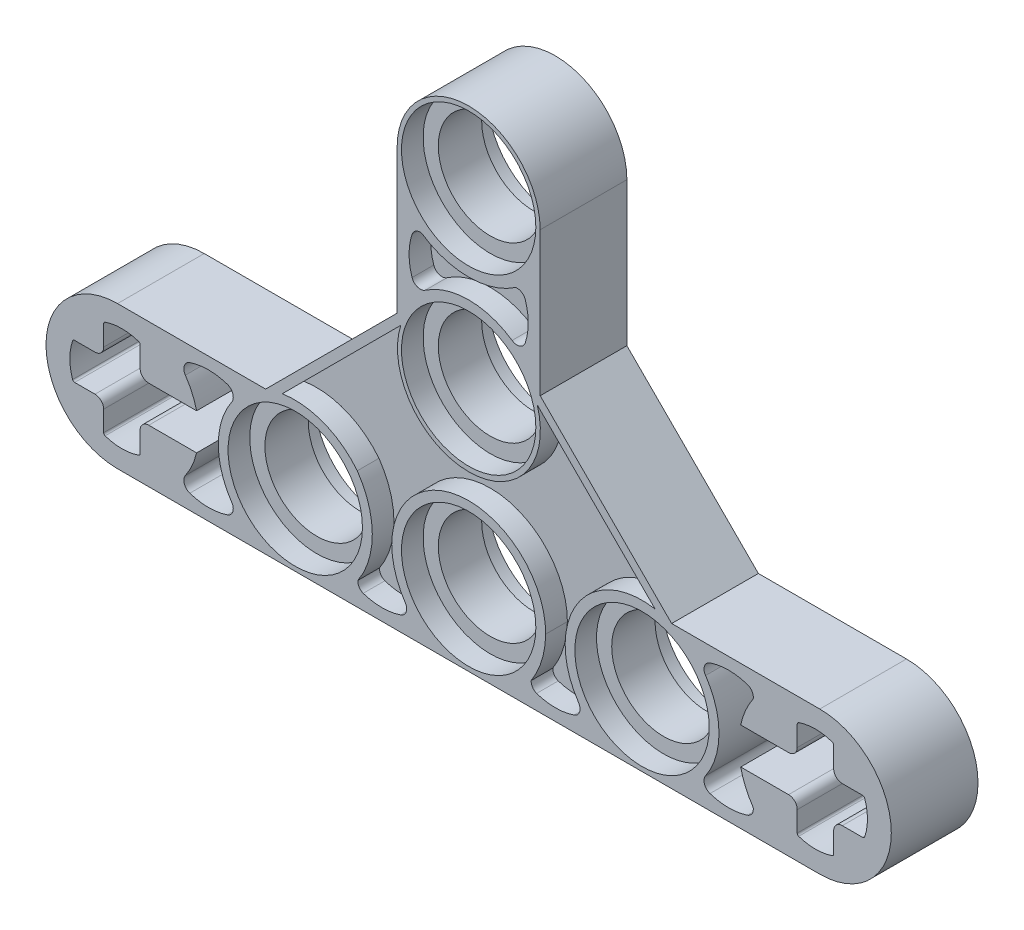
from build123d import *

# Parameters (mm, degrees)
SKETCH2_R           = 2.4
BOSS_EXTRUDE1_DEPTH = 2
SKETCH4_R           = 3.1
CUT_EXTRUDE1_DEPTH  = 1
CUT_EXTRUDE2_DEPTH  = 1


with BuildPart() as part:
    # Sketch2 → Boss-Extrude1 (new, symmetric)
    with BuildSketch(Plane.XY):
        with BuildLine():
            Line((-16.2, -3.3), (16.2, -3.3))
            ThreePointArc((16.2, -3.3), (19.5, 0), (16.2, 3.3))
            Line((16.2, 3.3), (9.366904756, 3.3))
            Line((9.366904756, 3.3), (3.3, 9.366904756))
            Line((3.3, 9.366904756), (3.3, 16))
            ThreePointArc((3.3, 16), (0, 19.3), (-3.3, 16))
            Line((-3.3, 16), (-3.3, 9.366904756))
            Line((-3.3, 9.366904756), (-9.366904756, 3.3))
            Line((-9.366904756, 3.3), (-16.2, 3.3))
            ThreePointArc((-16.2, 3.3), (-19.5, 0), (-16.2, -3.3))
        make_face()
        with BuildLine():
            Line((-18.177705214, 0.84), (-17.24, 0.84))
            ThreePointArc((-17.24, 0.84), (-16.957157288, 0.957157288), (-16.84, 1.24))
            Line((-16.84, 1.24), (-16.84, 2.177705214))
            ThreePointArc((-16.84, 2.177705214), (-16.821293884, 2.235940121), (-16.772173913, 2.27238805))
            ThreePointArc((-16.772173913, 2.27238805), (-16, 2.4), (-15.227826087, 2.27238805))
            ThreePointArc((-15.227826087, 2.27238805), (-15.178706116, 2.235940121), (-15.16, 2.177705214))
            Line((-15.16, 2.177705214), (-15.16, 1.24))
            ThreePointArc((-15.16, 1.24), (-15.042842712, 0.957157288), (-14.76, 0.84))
            Line((-14.76, 0.84), (-13.822294786, 0.84))
            Line((-13.822294786, 0.84), (-13.751800721, 0.84))
            Line((-13.751800721, 0.84), (-12.55081169, 0.84))
            ThreePointArc((-12.55081169, 0.84), (-12.757752494, 1.445797742), (-13.070126582, 2.004580194))
            ThreePointArc((-13.070126582, 2.004580194), (-13.119033599, 2.358251088), (-12.865957447, 2.610099174))
            ThreePointArc((-12.865957447, 2.610099174), (-12, 2.75), (-11.134042553, 2.610099174))
            ThreePointArc((-11.134042553, 2.610099174), (-10.880966401, 2.358251088), (-10.929873418, 2.004580194))
            ThreePointArc((-10.929873418, 2.004580194), (-11.55, 0), (-10.929873418, -2.004580194))
            ThreePointArc((-10.929873418, -2.004580194), (-10.880966401, -2.358251088), (-11.134042553, -2.610099174))
            ThreePointArc((-11.134042553, -2.610099174), (-12, -2.75), (-12.865957447, -2.610099174))
            ThreePointArc((-12.865957447, -2.610099174), (-13.119033599, -2.358251088), (-13.070126582, -2.004580194))
            ThreePointArc((-13.070126582, -2.004580194), (-12.757752494, -1.445797742), (-12.55081169, -0.84))
            Line((-12.55081169, -0.84), (-13.751800721, -0.84))
            Line((-13.751800721, -0.84), (-13.822294786, -0.84))
            Line((-13.822294786, -0.84), (-14.76, -0.84))
            ThreePointArc((-14.76, -0.84), (-15.042842712, -0.957157288), (-15.16, -1.24))
            Line((-15.16, -1.24), (-15.16, -2.177705214))
            ThreePointArc((-15.16, -2.177705214), (-15.178706116, -2.235940121), (-15.227826087, -2.27238805))
            ThreePointArc((-15.227826087, -2.27238805), (-16, -2.4), (-16.772173913, -2.27238805))
            ThreePointArc((-16.772173913, -2.27238805), (-16.821293884, -2.235940121), (-16.84, -2.177705214))
            Line((-16.84, -2.177705214), (-16.84, -1.24))
            ThreePointArc((-16.84, -1.24), (-16.957157288, -0.957157288), (-17.24, -0.84))
            Line((-17.24, -0.84), (-18.177705214, -0.84))
            ThreePointArc((-18.177705214, -0.84), (-18.235940121, -0.821293884), (-18.27238805, -0.772173913))
            ThreePointArc((-18.27238805, -0.772173913), (-18.4, 0), (-18.27238805, 0.772173913))
            ThreePointArc((-18.27238805, 0.772173913), (-18.235940121, 0.821293884), (-18.177705214, 0.84))
        make_face(mode=Mode.SUBTRACT)
        with Locations((-8, 0)):
            Circle(SKETCH2_R, mode=Mode.SUBTRACT)
        Circle(SKETCH2_R, mode=Mode.SUBTRACT)
        with Locations((8, 0)):
            Circle(SKETCH2_R, mode=Mode.SUBTRACT)
        with BuildLine():
            Line((16.84, 2.177705214), (16.84, 1.24))
            ThreePointArc((16.84, 1.24), (16.957157288, 0.957157288), (17.24, 0.84))
            Line((17.24, 0.84), (18.177705214, 0.84))
            ThreePointArc((18.177705214, 0.84), (18.235940121, 0.821293884), (18.27238805, 0.772173913))
            ThreePointArc((18.27238805, 0.772173913), (18.4, 0), (18.27238805, -0.772173913))
            ThreePointArc((18.27238805, -0.772173913), (18.235940121, -0.821293884), (18.177705214, -0.84))
            Line((18.177705214, -0.84), (17.24, -0.84))
            ThreePointArc((17.24, -0.84), (16.957157288, -0.957157288), (16.84, -1.24))
            Line((16.84, -1.24), (16.84, -2.177705214))
            ThreePointArc((16.84, -2.177705214), (16.821293884, -2.235940121), (16.772173913, -2.27238805))
            ThreePointArc((16.772173913, -2.27238805), (16, -2.4), (15.227826087, -2.27238805))
            ThreePointArc((15.227826087, -2.27238805), (15.178706116, -2.235940121), (15.16, -2.177705214))
            Line((15.16, -2.177705214), (15.16, -1.24))
            ThreePointArc((15.16, -1.24), (15.042842712, -0.957157288), (14.76, -0.84))
            Line((14.76, -0.84), (13.822294786, -0.84))
            Line((13.822294786, -0.84), (13.751800721, -0.84))
            Line((13.751800721, -0.84), (12.55081169, -0.84))
            ThreePointArc((12.55081169, -0.84), (12.776635558, -1.532291094), (13.129021511, -2.169541059))
            ThreePointArc((13.129021511, -2.169541059), (13.077439209, -2.437559337), (12.865957447, -2.610099174))
            ThreePointArc((12.865957447, -2.610099174), (12, -2.75), (11.134042553, -2.610099174))
            ThreePointArc((11.134042553, -2.610099174), (10.880966401, -2.358251088), (10.929873418, -2.004580194))
            ThreePointArc((10.929873418, -2.004580194), (11.55, 0), (10.929873418, 2.004580194))
            ThreePointArc((10.929873418, 2.004580194), (10.880966401, 2.358251088), (11.134042553, 2.610099174))
            ThreePointArc((11.134042553, 2.610099174), (12, 2.75), (12.865957447, 2.610099174))
            ThreePointArc((12.865957447, 2.610099174), (13.077439209, 2.437559337), (13.129021511, 2.169541059))
            ThreePointArc((13.129021511, 2.169541059), (12.776635558, 1.532291094), (12.55081169, 0.84))
            Line((12.55081169, 0.84), (13.751800721, 0.84))
            Line((13.751800721, 0.84), (13.822294786, 0.84))
            Line((13.822294786, 0.84), (14.76, 0.84))
            ThreePointArc((14.76, 0.84), (15.042842712, 0.957157288), (15.16, 1.24))
            Line((15.16, 1.24), (15.16, 2.177705214))
            ThreePointArc((15.16, 2.177705214), (15.178706116, 2.235940121), (15.227826087, 2.27238805))
            ThreePointArc((15.227826087, 2.27238805), (16, 2.4), (16.772173913, 2.27238805))
            ThreePointArc((16.772173913, 2.27238805), (16.821293884, 2.235940121), (16.84, 2.177705214))
        make_face(mode=Mode.SUBTRACT)
        with Locations((0, 8)):
            Circle(SKETCH2_R, mode=Mode.SUBTRACT)
        with Locations((0, 16)):
            Circle(SKETCH2_R, mode=Mode.SUBTRACT)
    extrude(amount=BOSS_EXTRUDE1_DEPTH, both=True)

    # Sketch4 → Cut-Extrude1 (cut)
    with BuildSketch(Plane.XY.offset(2)):
        Circle(SKETCH4_R)
        with Locations((8, 0)):
            Circle(SKETCH4_R)
        with Locations((-8, 0)):
            Circle(SKETCH4_R)
        with Locations((0, 8)):
            Circle(SKETCH4_R)
        with Locations((0, 16)):
            Circle(SKETCH4_R)
    cut_extrude1 = extrude(amount=-CUT_EXTRUDE1_DEPTH, mode=Mode.SUBTRACT)

    # Mirror1: Cut-Extrude1 across plane
    add(cut_extrude1.mirror(Plane.XY), mode=Mode.SUBTRACT)

    # Sketch5 → Cut-Extrude2 (cut)
    with BuildSketch(Plane(origin=(0, 0, -2), x_dir=(-1, 0, 0), z_dir=(0, 0, -1))):
        with BuildLine():
            Line((-8.60453447, 3.495846804), (-3.165930566, 8.934450707))
            ThreePointArc((-3.165930566, 8.934450707), (0.003594416, 4.67910033), (3.132274525, 8.964570692))
            Line((3.132274525, 8.964570692), (8.600998413, 3.495846805))
            ThreePointArc((8.600998413, 3.495846805), (6.687659559, 3.291708126), (5.13869376, 2.150111385))
            ThreePointArc((5.13869376, 2.150111385), (4.445544513, -0.03189944), (5.116625895, -2.220797997))
            ThreePointArc((5.116625895, -2.220797997), (5.053346481, -2.455405267), (4.865957447, -2.610099174))
            ThreePointArc((4.865957447, -2.610099174), (4, -2.75), (3.134042553, -2.610099174))
            ThreePointArc((3.134042553, -2.610099174), (2.881472437, -2.359742175), (2.92810539, -2.00718628))
            ThreePointArc((2.92810539, -2.00718628), (3.386475023, -1.04926651), (3.549988588, 7.677e-06))
            ThreePointArc((3.549988588, 7.677e-06), (-0.017368929, 3.527999325), (-3.554486224, -0.030310098))
            ThreePointArc((-3.554486224, -0.030310098), (-3.373822587, -1.173009312), (-2.883374105, -2.220797997))
            ThreePointArc((-2.883374105, -2.220797997), (-2.946653519, -2.455405267), (-3.134042553, -2.610099174))
            ThreePointArc((-3.134042553, -2.610099174), (-4, -2.75), (-4.865957447, -2.610099174))
            ThreePointArc((-4.865957447, -2.610099174), (-5.118527563, -2.359742175), (-5.07189461, -2.00718628))
            ThreePointArc((-5.07189461, -2.00718628), (-4.451768028, -0.002606085), (-5.07189461, 2.001974109))
            ThreePointArc((-5.07189461, 2.001974109), (-6.61910009, 3.267061998), (-8.60453447, 3.495846804))
        make_face()
        with BuildLine():
            ThreePointArc((2.610099174, 11.134042553), (2.75, 12), (2.610099174, 12.865957447))
            ThreePointArc((2.610099174, 12.865957447), (2.437559337, 13.077439209), (2.169541059, 13.129021511))
            ThreePointArc((2.169541059, 13.129021511), (0, 12.457863487), (-2.169541059, 13.129021511))
            ThreePointArc((-2.169541059, 13.129021511), (-2.437559337, 13.077439209), (-2.610099174, 12.865957447))
            ThreePointArc((-2.610099174, 12.865957447), (-2.75, 12), (-2.610099174, 11.134042553))
            ThreePointArc((-2.610099174, 11.134042553), (-2.358251088, 10.880966401), (-2.004580194, 10.929873418))
            ThreePointArc((-2.004580194, 10.929873418), (0, 11.55), (2.004580194, 10.929873418))
            ThreePointArc((2.004580194, 10.929873418), (2.358251088, 10.880966401), (2.610099174, 11.134042553))
        make_face()
    cut_extrude2 = extrude(amount=-CUT_EXTRUDE2_DEPTH, mode=Mode.SUBTRACT)

    # Mirror2: Cut-Extrude2 across plane
    add(cut_extrude2.mirror(Plane.XY), mode=Mode.SUBTRACT)


solid = part.part
